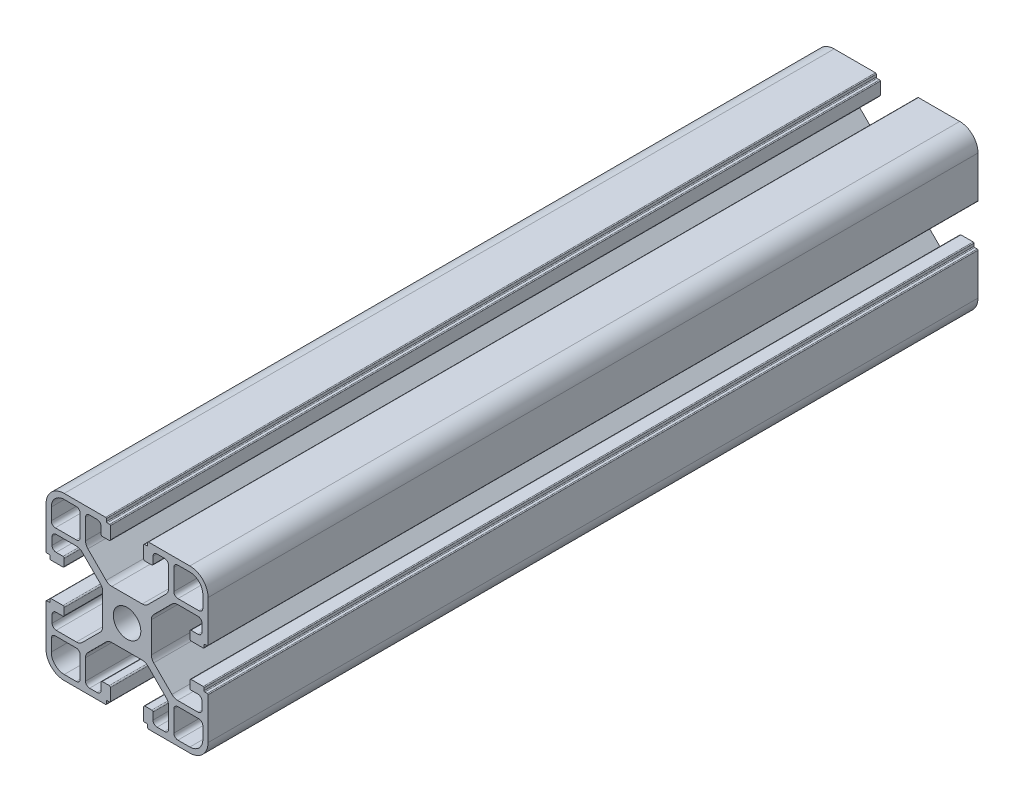
from build123d import *

# Parameters (mm, degrees)
SKETCH2_R           = 3.4
BOSS_EXTRUDE1_DEPTH = 190
SKETCH4_R           = 2.5
CUT_EXTRUDE1_DEPTH  = 199.242276016


with BuildPart() as part:
    # Sketch2 → Boss-Extrude1 (new body)
    with BuildSketch(Plane.XY):
        with BuildLine():
            Line((4.5, 0), (14.7, 0))
            ThreePointArc((14.7, 0), (14.841421356, 0.058578644), (14.9, 0.2))
            Line((14.9, 0.2), (14.9, 0.8))
            ThreePointArc((14.9, 0.8), (14.958578644, 0.941421356), (15.1, 1))
            Line((15.1, 1), (15.7, 1))
            ThreePointArc((15.7, 1), (15.841421356, 1.058578644), (15.9, 1.2))
            Line((15.9, 1.2), (15.9, 4.2))
            ThreePointArc((15.9, 4.2), (15.812132034, 4.412132034), (15.6, 4.5))
            Line((15.6, 4.5), (13.9, 4.5))
            ThreePointArc((13.9, 4.5), (13.687867966, 4.412132034), (13.6, 4.2))
            Line((13.6, 4.2), (13.6, 2.5))
            ThreePointArc((13.6, 2.5), (13.307106781, 1.792893219), (12.6, 1.5))
            Line((12.6, 1.5), (10.75, 1.5))
            ThreePointArc((10.75, 1.5), (10.042893219, 1.792893219), (9.75, 2.5))
            Line((9.75, 2.5), (9.75, 7.507359313))
            ThreePointArc((9.75, 7.507359313), (9.902240935, 8.272726178), (10.335786438, 8.921572875))
            Line((10.335786438, 8.921572875), (14.828427125, 13.414213562))
            ThreePointArc((14.828427125, 13.414213562), (15.477273822, 13.847759065), (16.242640687, 14))
            Line((16.242640687, 14), (23.757359313, 14))
            ThreePointArc((23.757359313, 14), (24.522726178, 13.847759065), (25.171572875, 13.414213562))
            Line((25.171572875, 13.414213562), (29.664213562, 8.921572875))
            ThreePointArc((29.664213562, 8.921572875), (30.097759065, 8.272726178), (30.25, 7.507359313))
            Line((30.25, 7.507359313), (30.25, 2.5))
            ThreePointArc((30.25, 2.5), (29.957106781, 1.792893219), (29.25, 1.5))
            Line((29.25, 1.5), (27.4, 1.5))
            ThreePointArc((27.4, 1.5), (26.692893219, 1.792893219), (26.4, 2.5))
            Line((26.4, 2.5), (26.4, 4.2))
            ThreePointArc((26.4, 4.2), (26.312132034, 4.412132034), (26.1, 4.5))
            Line((26.1, 4.5), (24.4, 4.5))
            ThreePointArc((24.4, 4.5), (24.187867966, 4.412132034), (24.1, 4.2))
            Line((24.1, 4.2), (24.1, 1.2))
            ThreePointArc((24.1, 1.2), (24.158578644, 1.058578644), (24.3, 1))
            Line((24.3, 1), (24.9, 1))
            ThreePointArc((24.9, 1), (25.041421356, 0.941421356), (25.1, 0.8))
            Line((25.1, 0.8), (25.1, 0.2))
            ThreePointArc((25.1, 0.2), (25.158578644, 0.058578644), (25.3, 0))
            Line((25.3, 0), (35.5, 0))
            ThreePointArc((35.5, 0), (38.681980515, 1.318019485), (40, 4.5))
            Line((40, 4.5), (40, 14.7))
            ThreePointArc((40, 14.7), (39.941421356, 14.841421356), (39.8, 14.9))
            Line((39.8, 14.9), (39.2, 14.9))
            ThreePointArc((39.2, 14.9), (39.058578644, 14.958578644), (39, 15.1))
            Line((39, 15.1), (39, 15.7))
            ThreePointArc((39, 15.7), (38.941421356, 15.841421356), (38.8, 15.9))
            Line((38.8, 15.9), (35.8, 15.9))
            ThreePointArc((35.8, 15.9), (35.587867966, 15.812132034), (35.5, 15.6))
            Line((35.5, 15.6), (35.5, 13.9))
            ThreePointArc((35.5, 13.9), (35.587867966, 13.687867966), (35.8, 13.6))
            Line((35.8, 13.6), (37.5, 13.6))
            ThreePointArc((37.5, 13.6), (38.207106781, 13.307106781), (38.5, 12.6))
            Line((38.5, 12.6), (38.5, 10.75))
            ThreePointArc((38.5, 10.75), (38.207106781, 10.042893219), (37.5, 9.75))
            Line((37.5, 9.75), (32.492640687, 9.75))
            ThreePointArc((32.492640687, 9.75), (31.727273822, 9.902240935), (31.078427125, 10.335786438))
            Line((31.078427125, 10.335786438), (26.585786438, 14.828427125))
            ThreePointArc((26.585786438, 14.828427125), (26.152240935, 15.477273822), (26, 16.242640687))
            Line((26, 16.242640687), (26, 23.757359313))
            ThreePointArc((26, 23.757359313), (26.152240935, 24.522726178), (26.585786438, 25.171572875))
            Line((26.585786438, 25.171572875), (31.078427125, 29.664213562))
            ThreePointArc((31.078427125, 29.664213562), (31.727273822, 30.097759065), (32.492640687, 30.25))
            Line((32.492640687, 30.25), (37.5, 30.25))
            ThreePointArc((37.5, 30.25), (38.207106781, 29.957106781), (38.5, 29.25))
            Line((38.5, 29.25), (38.5, 27.4))
            ThreePointArc((38.5, 27.4), (38.207106781, 26.692893219), (37.5, 26.4))
            Line((37.5, 26.4), (35.8, 26.4))
            ThreePointArc((35.8, 26.4), (35.587867966, 26.312132034), (35.5, 26.1))
            Line((35.5, 26.1), (35.5, 24.4))
            ThreePointArc((35.5, 24.4), (35.587867966, 24.187867966), (35.8, 24.1))
            Line((35.8, 24.1), (38.8, 24.1))
            ThreePointArc((38.8, 24.1), (38.941421356, 24.158578644), (39, 24.3))
            Line((39, 24.3), (39, 24.9))
            ThreePointArc((39, 24.9), (39.058578644, 25.041421356), (39.2, 25.1))
            Line((39.2, 25.1), (39.8, 25.1))
            ThreePointArc((39.8, 25.1), (39.941421356, 25.158578644), (40, 25.3))
            Line((40, 25.3), (40, 35.5))
            ThreePointArc((40, 35.5), (38.681980515, 38.681980515), (35.5, 40))
            Line((35.5, 40), (25.3, 40))
            ThreePointArc((25.3, 40), (25.158578644, 39.941421356), (25.1, 39.8))
            Line((25.1, 39.8), (25.1, 39.2))
            ThreePointArc((25.1, 39.2), (25.041421356, 39.058578644), (24.9, 39))
            Line((24.9, 39), (24.3, 39))
            ThreePointArc((24.3, 39), (24.158578644, 38.941421356), (24.1, 38.8))
            Line((24.1, 38.8), (24.1, 35.8))
            ThreePointArc((24.1, 35.8), (24.187867966, 35.587867966), (24.4, 35.5))
            Line((24.4, 35.5), (26.1, 35.5))
            ThreePointArc((26.1, 35.5), (26.312132034, 35.587867966), (26.4, 35.8))
            Line((26.4, 35.8), (26.4, 37.5))
            ThreePointArc((26.4, 37.5), (26.692893219, 38.207106781), (27.4, 38.5))
            Line((27.4, 38.5), (29.25, 38.5))
            ThreePointArc((29.25, 38.5), (29.957106781, 38.207106781), (30.25, 37.5))
            Line((30.25, 37.5), (30.25, 32.492640687))
            ThreePointArc((30.25, 32.492640687), (30.097759065, 31.727273822), (29.664213562, 31.078427125))
            Line((29.664213562, 31.078427125), (25.171572875, 26.585786438))
            ThreePointArc((25.171572875, 26.585786438), (24.522726178, 26.152240935), (23.757359313, 26))
            Line((23.757359313, 26), (16.242640687, 26))
            ThreePointArc((16.242640687, 26), (15.477273822, 26.152240935), (14.828427125, 26.585786438))
            Line((14.828427125, 26.585786438), (10.335786438, 31.078427125))
            ThreePointArc((10.335786438, 31.078427125), (9.902240935, 31.727273822), (9.75, 32.492640687))
            Line((9.75, 32.492640687), (9.75, 37.5))
            ThreePointArc((9.75, 37.5), (10.042893219, 38.207106781), (10.75, 38.5))
            Line((10.75, 38.5), (12.6, 38.5))
            ThreePointArc((12.6, 38.5), (13.307106781, 38.207106781), (13.6, 37.5))
            Line((13.6, 37.5), (13.6, 35.8))
            ThreePointArc((13.6, 35.8), (13.687867966, 35.587867966), (13.9, 35.5))
            Line((13.9, 35.5), (15.6, 35.5))
            ThreePointArc((15.6, 35.5), (15.812132034, 35.587867966), (15.9, 35.8))
            Line((15.9, 35.8), (15.9, 38.8))
            ThreePointArc((15.9, 38.8), (15.841421356, 38.941421356), (15.7, 39))
            Line((15.7, 39), (15.1, 39))
            ThreePointArc((15.1, 39), (14.958578644, 39.058578644), (14.9, 39.2))
            Line((14.9, 39.2), (14.9, 39.8))
            ThreePointArc((14.9, 39.8), (14.841421356, 39.941421356), (14.7, 40))
            Line((14.7, 40), (4.5, 40))
            ThreePointArc((4.5, 40), (1.318019485, 38.681980515), (0, 35.5))
            Line((0, 35.5), (0, 25.3))
            ThreePointArc((0, 25.3), (0.058578644, 25.158578644), (0.2, 25.1))
            Line((0.2, 25.1), (0.8, 25.1))
            ThreePointArc((0.8, 25.1), (0.941421356, 25.041421356), (1, 24.9))
            Line((1, 24.9), (1, 24.3))
            ThreePointArc((1, 24.3), (1.058578644, 24.158578644), (1.2, 24.1))
            Line((1.2, 24.1), (4.2, 24.1))
            ThreePointArc((4.2, 24.1), (4.412132034, 24.187867966), (4.5, 24.4))
            Line((4.5, 24.4), (4.5, 26.1))
            ThreePointArc((4.5, 26.1), (4.412132034, 26.312132034), (4.2, 26.4))
            Line((4.2, 26.4), (2.5, 26.4))
            ThreePointArc((2.5, 26.4), (1.792893219, 26.692893219), (1.5, 27.4))
            Line((1.5, 27.4), (1.5, 29.25))
            ThreePointArc((1.5, 29.25), (1.792893219, 29.957106781), (2.5, 30.25))
            Line((2.5, 30.25), (7.507359313, 30.25))
            ThreePointArc((7.507359313, 30.25), (8.272726178, 30.097759065), (8.921572875, 29.664213562))
            Line((8.921572875, 29.664213562), (13.414213562, 25.171572875))
            ThreePointArc((13.414213562, 25.171572875), (13.847759065, 24.522726178), (14, 23.757359313))
            Line((14, 23.757359313), (14, 16.242640687))
            ThreePointArc((14, 16.242640687), (13.847759065, 15.477273822), (13.414213562, 14.828427125))
            Line((13.414213562, 14.828427125), (8.921572875, 10.335786438))
            ThreePointArc((8.921572875, 10.335786438), (8.272726178, 9.902240935), (7.507359313, 9.75))
            Line((7.507359313, 9.75), (2.5, 9.75))
            ThreePointArc((2.5, 9.75), (1.792893219, 10.042893219), (1.5, 10.75))
            Line((1.5, 10.75), (1.5, 12.6))
            ThreePointArc((1.5, 12.6), (1.792893219, 13.307106781), (2.5, 13.6))
            Line((2.5, 13.6), (4.2, 13.6))
            ThreePointArc((4.2, 13.6), (4.412132034, 13.687867966), (4.5, 13.9))
            Line((4.5, 13.9), (4.5, 15.6))
            ThreePointArc((4.5, 15.6), (4.412132034, 15.812132034), (4.2, 15.9))
            Line((4.2, 15.9), (1.2, 15.9))
            ThreePointArc((1.2, 15.9), (1.058578644, 15.841421356), (1, 15.7))
            Line((1, 15.7), (1, 15.1))
            ThreePointArc((1, 15.1), (0.941421356, 14.958578644), (0.8, 14.9))
            Line((0.8, 14.9), (0.2, 14.9))
            ThreePointArc((0.2, 14.9), (0.058578644, 14.841421356), (0, 14.7))
            Line((0, 14.7), (0, 4.5))
            ThreePointArc((0, 4.5), (1.318019485, 1.318019485), (4.5, 0))
        make_face()
        with Locations((20, 20)):
            Circle(SKETCH2_R, mode=Mode.SUBTRACT)
        with BuildLine():
            Line((31.55, 37.7), (31.55, 32.55))
            ThreePointArc((31.55, 32.55), (31.842893219, 31.842893219), (32.55, 31.55))
            Line((32.55, 31.55), (37.7, 31.55))
            ThreePointArc((37.7, 31.55), (38.407106781, 31.842893219), (38.7, 32.55))
            Line((38.7, 32.55), (38.7, 35.5))
            ThreePointArc((38.7, 35.5), (37.7627417, 37.7627417), (35.5, 38.7))
            Line((35.5, 38.7), (32.55, 38.7))
            ThreePointArc((32.55, 38.7), (31.842893219, 38.407106781), (31.55, 37.7))
        make_face(mode=Mode.SUBTRACT)
        with BuildLine():
            Line((1.3, 35.5), (1.3, 32.55))
            ThreePointArc((1.3, 32.55), (1.592893219, 31.842893219), (2.3, 31.55))
            Line((2.3, 31.55), (7.45, 31.55))
            ThreePointArc((7.45, 31.55), (8.157106781, 31.842893219), (8.45, 32.55))
            Line((8.45, 32.55), (8.45, 37.7))
            ThreePointArc((8.45, 37.7), (8.157106781, 38.407106781), (7.45, 38.7))
            Line((7.45, 38.7), (4.5, 38.7))
            ThreePointArc((4.5, 38.7), (2.2372583, 37.7627417), (1.3, 35.5))
        make_face(mode=Mode.SUBTRACT)
        with BuildLine():
            Line((1.3, 7.45), (1.3, 4.5))
            ThreePointArc((1.3, 4.5), (2.2372583, 2.2372583), (4.5, 1.3))
            Line((4.5, 1.3), (7.45, 1.3))
            ThreePointArc((7.45, 1.3), (8.157106781, 1.592893219), (8.45, 2.3))
            Line((8.45, 2.3), (8.45, 7.45))
            ThreePointArc((8.45, 7.45), (8.157106781, 8.157106781), (7.45, 8.45))
            Line((7.45, 8.45), (2.3, 8.45))
            ThreePointArc((2.3, 8.45), (1.592893219, 8.157106781), (1.3, 7.45))
        make_face(mode=Mode.SUBTRACT)
        with BuildLine():
            Line((31.55, 7.45), (31.55, 2.3))
            ThreePointArc((31.55, 2.3), (31.842893219, 1.592893219), (32.55, 1.3))
            Line((32.55, 1.3), (35.5, 1.3))
            ThreePointArc((35.5, 1.3), (37.7627417, 2.2372583), (38.7, 4.5))
            Line((38.7, 4.5), (38.7, 7.45))
            ThreePointArc((38.7, 7.45), (38.407106781, 8.157106781), (37.7, 8.45))
            Line((37.7, 8.45), (32.55, 8.45))
            ThreePointArc((32.55, 8.45), (31.842893219, 8.157106781), (31.55, 7.45))
        make_face(mode=Mode.SUBTRACT)
    extrude(amount=BOSS_EXTRUDE1_DEPTH)

    # Sketch4 → Cut-Extrude1 (cut, through all)
    with BuildSketch(Plane.ZY):
        with Locations(Location((15, 20, 0), (0, 0, 270))):
            Circle(SKETCH4_R)
        with Locations(Location((68, 20, 0), (0, 0, 270))):
            Circle(SKETCH4_R)
    extrude(amount=-CUT_EXTRUDE1_DEPTH, mode=Mode.SUBTRACT)


solid = part.part
